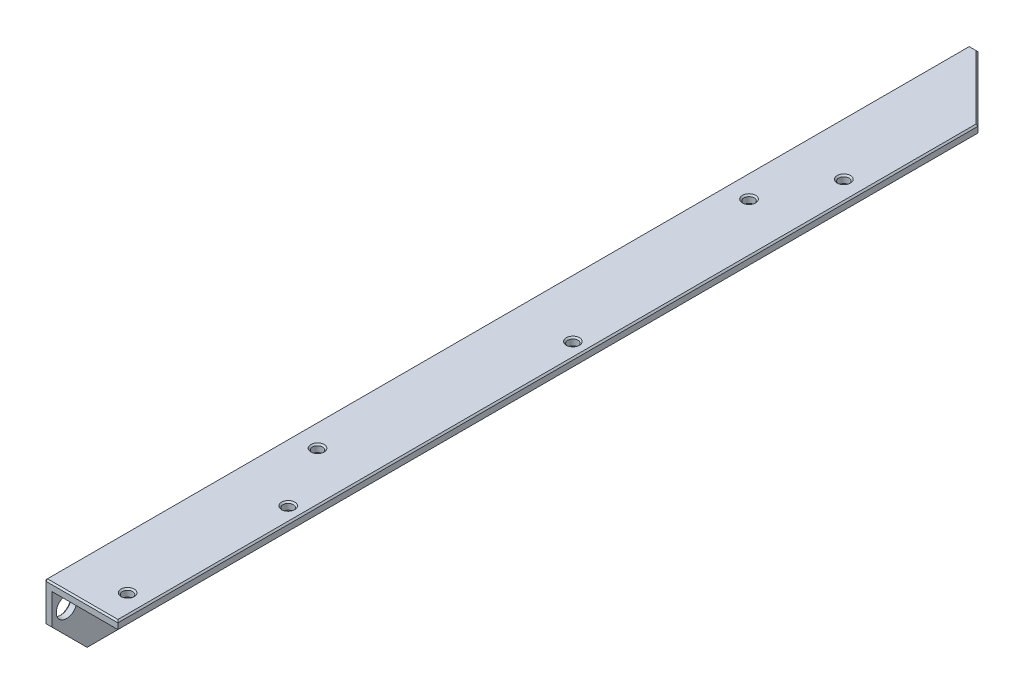
from build123d import *

# Parameters (mm, degrees)
BASE_EXTRUSION_DEPTH     = 315
ESQUISSE3_R              = 1.75
ENL_V_MAT_EXTRU_2_DEPTH  = 3
ENL_V_MAT_EXTRU_5_DEPTH  = 3
ENL_V_MAT_EXTRU_6_DEPTH  = 3
ENL_V_MAT_EXTRU_9_DEPTH  = 3
ESQUISSE8_R              = 3.5
ENL_V_MAT_EXTRU_10_DEPTH = 3
CHANFREIN1_SIZE          = 0.5


with BuildPart() as part:
    # Esquisse1 → Base-Extrusion (new body)
    with BuildSketch(Plane.XY):
        Polygon((0, 0), (0, 25), (25, 25), (25, 22.5), (2.5, 22.5), (2.5, 0), align=None)
    extrude(amount=BASE_EXTRUSION_DEPTH)

    # Esquisse3 → Enlèv. mat.-Extru.2 (cut)
    with BuildSketch(Plane(origin=(0, 25, 0), x_dir=(-1, 0, 0), z_dir=(0, 1, 0))):
        with Locations(Location((-18.3, 61, 0), (0, 0, 90))):
            Circle(ESQUISSE3_R)
        with Locations(Location((-8, 83, 0), (0, 0, 90))):
            Circle(ESQUISSE3_R)
        with Locations(Location((-20, 155, 0), (0, 0, 90))):
            Circle(ESQUISSE3_R)
        with Locations(Location((-8, 230, 0), (0, 0, 90))):
            Circle(ESQUISSE3_R)
        with Locations(Location((-20, 252, 0), (0, 0, 90))):
            Circle(ESQUISSE3_R)
        with Locations(Location((-18.3, 305, 0), (0, 0, 90))):
            Circle(ESQUISSE3_R)
    extrude(amount=-ENL_V_MAT_EXTRU_2_DEPTH, mode=Mode.SUBTRACT)

    # Esquisse5 → Enlèv. mat.-Extru.5 (cut)
    with BuildSketch(Plane(origin=(0, 25, 0), x_dir=(-1, 0, 0), z_dir=(0, 1, 0))):
        Polygon((-3, 0), (-25, 22), (-25, 0), align=None)
    extrude(amount=-ENL_V_MAT_EXTRU_5_DEPTH, mode=Mode.SUBTRACT)

    # Esquisse6 → Enlèv. mat.-Extru.6 (cut)
    with BuildSketch(Plane.ZY):
        Polygon((315, 12), (303, 0), (315, 0), align=None)
    extrude(amount=-ENL_V_MAT_EXTRU_6_DEPTH, mode=Mode.SUBTRACT)

    # Esquisse7 → Enlèv. mat.-Extru.9 (cut)
    with BuildSketch(Plane.ZY):
        with BuildLine():
            Line((255, 0), (255, 13.5))
            ThreePointArc((255, 13.5), (255.732233047, 15.267766953), (257.5, 16))
            Line((257.5, 16), (272.5, 16))
            ThreePointArc((272.5, 16), (274.267766953, 15.267766953), (275, 13.5))
            Line((275, 13.5), (275, 0))
            Line((275, 0), (255, 0))
        make_face()
    extrude(amount=-ENL_V_MAT_EXTRU_9_DEPTH, mode=Mode.SUBTRACT)

    # Esquisse8 → Enlèv. mat.-Extru.10 (cut)
    with BuildSketch(Plane.ZY):
        with Locations((310, 15.5)):
            Circle(ESQUISSE8_R)
        with Locations((5, 15.5)):
            Circle(ESQUISSE8_R)
    extrude(amount=-ENL_V_MAT_EXTRU_10_DEPTH, mode=Mode.SUBTRACT)

    # Chanfrein1
    chanfrein1_edges = [part.edges().sort_by_distance(p)[0] for p in [
        (0, 12.5, 0),
        (0, 0, 127.5),
        (0, 25, 157.5),
        (0, 6.75, 255),
        (0, 18.5, 315),
        (0, 15.267766953, 255.732233047),
        (0, 6, 309),
        (0, 16, 265),
        (0, 0, 289),
        (0, 15.267766953, 274.267766953),
        (0, 6.75, 275),
        (0, 15.5, 306.5),
        (0, 15.5, 1.5),
        (1.5, 25, 0),
        (14, 25, 11),
        (25, 25, 168.5),
        (12.5, 25, 315),
        (8, 25, 228.25),
        (18.3, 25, 303.25),
        (20, 25, 250.25),
        (8, 25, 81.25),
        (20, 25, 153.25),
        (18.3, 25, 59.25),
    ]]
    chamfer(chanfrein1_edges, length=CHANFREIN1_SIZE)


solid = part.part
